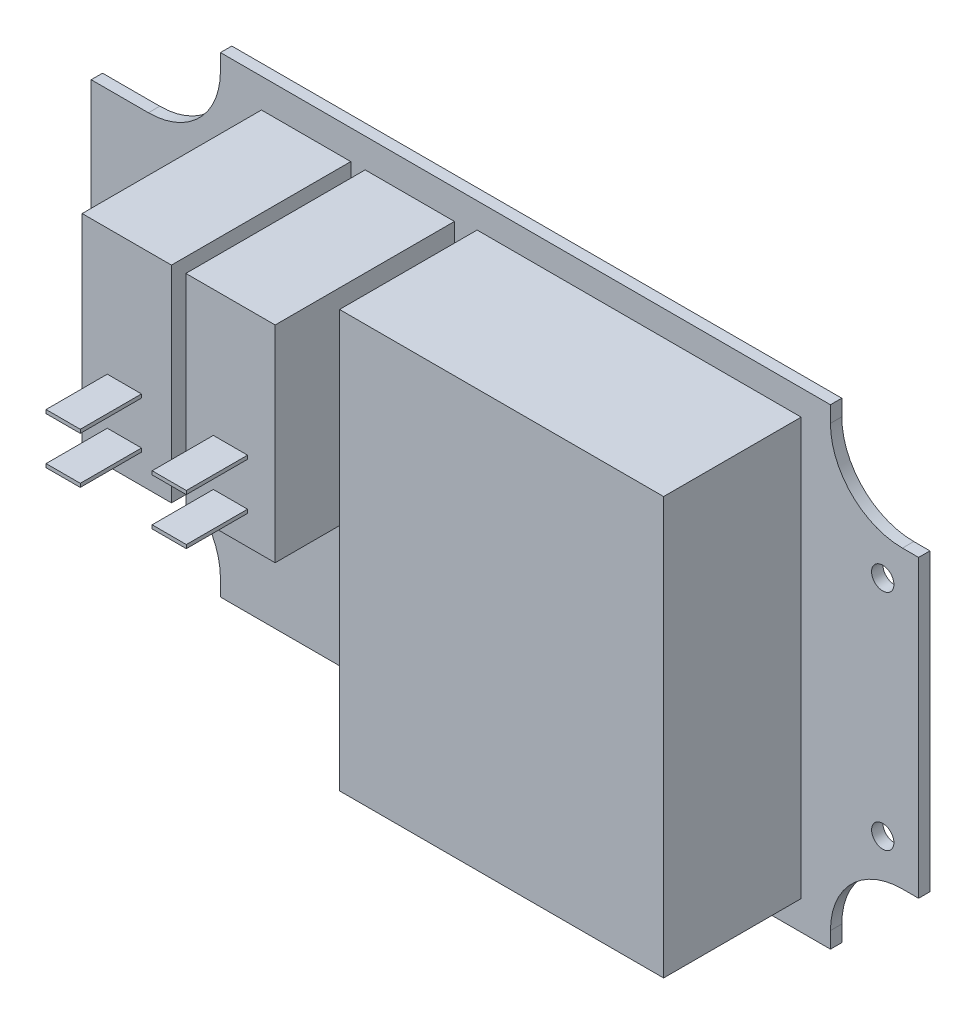
from build123d import *

# Parameters (mm, degrees)
SKETCH1_R           = 1.55
BOSS_EXTRUDE1_DEPTH = 1.5748
SKETCH2_W           = 12.4
SKETCH2_H           = 28.6
BOSS_EXTRUDE2_DEPTH = 24.9
SKETCH3_W           = 4.75
SKETCH3_H           = 0.5
BOSS_EXTRUDE3_DEPTH = 8.5
SKETCH4_W           = 45
SKETCH4_H           = 57.9
BOSS_EXTRUDE4_DEPTH = 19.1


with BuildPart() as part:
    # Sketch1 → Boss-Extrude1 (new body)
    with BuildSketch(Plane.XY):
        with BuildLine():
            Line((42.354093023, -30.703264053), (42.354093023, -32.943264053))
            Line((42.354093023, -32.943264053), (-42.354093023, -32.943264053))
            Line((-42.354093023, -32.943264053), (-42.354093023, -30.703264053))
            ThreePointArc((-42.354093023, -30.703264053), (-45.283025211, -23.632196241), (-52.354093023, -20.703264053))
            Line((-52.354093023, -20.703264053), (-60.301272865, -20.703264053))
            Line((-60.301272865, -20.703264053), (-60.301272865, 20.296735947))
            Line((-60.301272865, 20.296735947), (-52.354093023, 20.296735947))
            ThreePointArc((-52.354093023, 20.296735947), (-45.283025211, 23.225668135), (-42.354093023, 30.296735947))
            Line((-42.354093023, 30.296735947), (-42.354093023, 32.536735947))
            Line((-42.354093023, 32.536735947), (42.354093023, 32.536735947))
            Line((42.354093023, 32.536735947), (42.354093023, 30.296735947))
            ThreePointArc((42.354093023, 30.296735947), (45.283025211, 23.225668135), (52.354093023, 20.296735947))
            Line((52.354093023, 20.296735947), (54.593335979, 20.296735947))
            Line((54.593335979, 20.296735947), (54.593335979, -20.703264053))
            Line((54.593335979, -20.703264053), (52.354093023, -20.703264053))
            ThreePointArc((52.354093023, -20.703264053), (45.283025211, -23.632196241), (42.354093023, -30.703264053))
        make_face()
        with Locations((49.618335979, -15.728264053)):
            Circle(SKETCH1_R, mode=Mode.SUBTRACT)
        with Locations((49.618335979, 15.321735947)):
            Circle(SKETCH1_R, mode=Mode.SUBTRACT)
    extrude(amount=BOSS_EXTRUDE1_DEPTH)

    # Sketch2 → Boss-Extrude2 (add)
    with BuildSketch(Plane.XY.offset(1.5748)):
        with Locations((-30.457181744, 14.174173465)):
            Rectangle(SKETCH2_W, SKETCH2_H)
        with Locations((-16.057181744, 14.174173465)):
            Rectangle(SKETCH2_W, SKETCH2_H)
    extrude(amount=BOSS_EXTRUDE2_DEPTH)

    # Sketch3 → Boss-Extrude3 (add)
    with BuildSketch(Plane.XY.offset(26.4748)):
        with Locations((-16.064182879, 4.152019918)):
            Rectangle(SKETCH3_W, SKETCH3_H)
        with Locations((-16.064182879, 10.652019918)):
            Rectangle(SKETCH3_W, SKETCH3_H)
        with Locations((-30.792693371, 4.152019918)):
            Rectangle(SKETCH3_W, SKETCH3_H)
        with Locations((-30.792693371, 10.652019918)):
            Rectangle(SKETCH3_W, SKETCH3_H)
    extrude(amount=BOSS_EXTRUDE3_DEPTH)

    # Sketch4 → Boss-Extrude4 (add)
    with BuildSketch(Plane.XY.offset(1.5748)):
        with Locations((15.786645431, 0.061567403)):
            Rectangle(SKETCH4_W, SKETCH4_H)
    extrude(amount=BOSS_EXTRUDE4_DEPTH)


solid = part.part
